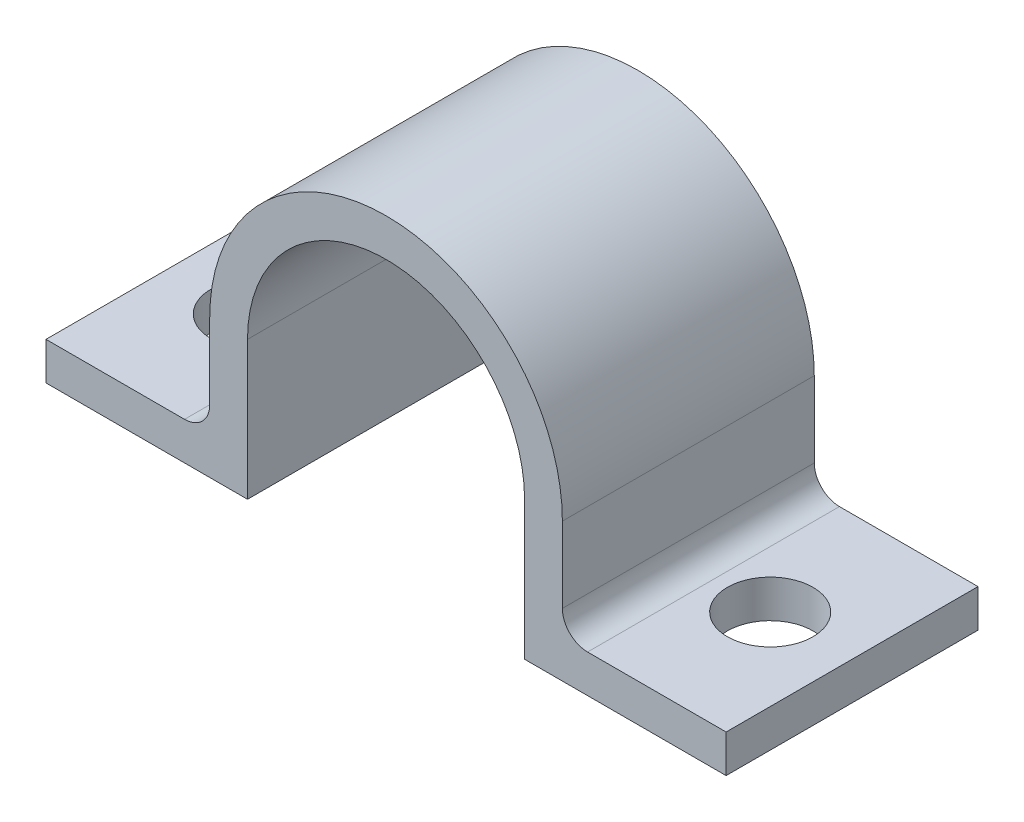
from build123d import *

# Parameters (mm, degrees)
BOSS_EXTRUDE1_DEPTH = 10
SKETCH2_R           = 1.7
CUT_EXTRUDE1_DEPTH  = 21.081085628
FILLET1_R           = 1


with BuildPart() as part:
    # Sketch1 → Boss-Extrude1 (new body)
    with BuildSketch(Plane.XY):
        with BuildLine():
            Line((-13.5, 0), (-13.5, 1.5))
            Line((-13.5, 1.5), (-7, 1.5))
            Line((-7, 1.5), (-7, 5.5))
            ThreePointArc((-7, 5.5), (0, 12.5), (7, 5.5))
            Line((7, 5.5), (7, 1.5))
            Line((7, 1.5), (13.5, 1.5))
            Line((13.5, 1.5), (13.5, 0))
            Line((13.5, 0), (5.5, 0))
            Line((5.5, 0), (5.5, 5.5))
            ThreePointArc((5.5, 5.5), (0, 11), (-5.5, 5.5))
            Line((-5.5, 5.5), (-5.5, 0))
            Line((-5.5, 0), (-13.5, 0))
        make_face()
    extrude(amount=BOSS_EXTRUDE1_DEPTH)

    # Sketch2 → Cut-Extrude1 (cut, through all)
    with BuildSketch(Plane(origin=(0, 1.5, 0), x_dir=(1, 0, 0), z_dir=(0, 1, 0))):
        with Locations(Location((10.25, -5, 0), (0, 0, 180))):
            Circle(SKETCH2_R)
    cut_extrude1 = extrude(amount=-CUT_EXTRUDE1_DEPTH, mode=Mode.SUBTRACT)

    # Fillet1
    fillet1_edges = [part.edges().sort_by_distance(p)[0] for p in [
        (-7, 1.5, 5),
        (7, 1.5, 5),
    ]]
    fillet(fillet1_edges, radius=FILLET1_R)

    # Mirror1: Cut-Extrude1 across plane
    add(cut_extrude1.mirror(Plane(origin=(0, 0, 0), x_dir=(0, 0, 1), z_dir=(1, 0, 0))), mode=Mode.SUBTRACT)


solid = part.part
